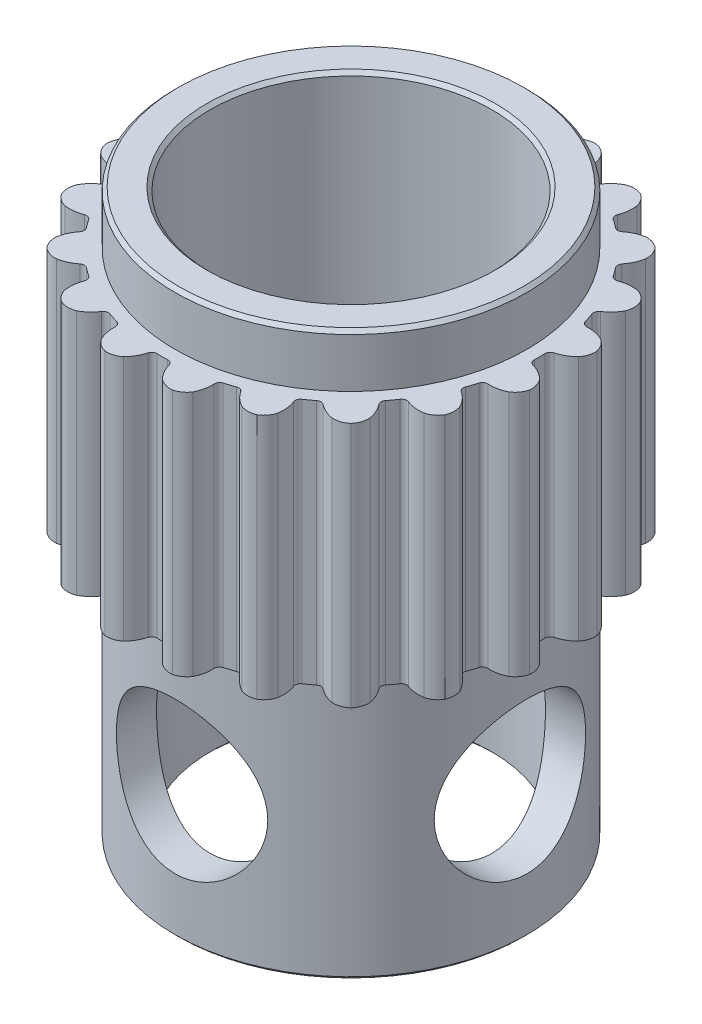
from build123d import *

# Parameters (mm, degrees)
BODY_SKETCH_W                   = 2.11
BODY_SKETCH_H                   = 7
GT2_PROFILE_DEPTH               = 3.5
GT2_CIRCULAR_PATTERN_COUNT      = 20
TOP_WALL_SKETCH_R               = 5
TOP_WALL_SKETCH_R_2             = 4
TOP_WALL_DEPTH                  = 1.5
BOTTOM_START                    = 7.5
BOTTOMWALLS_R                   = 5
BOTTOMWALLS_R_2                 = 4
BOTTOM_WALL_DEPTH               = 7.5
SET_SCREW_CLEARANCE_HOLE_REACH  = 18.71
SET_SCREW_CLEARANCE_HOLE_BORE_R = 2.15
SET_SCREW_HOLE_PATTERN_COUNT    = 2
SET_SCREW_HOLE_PATTERN_ANGLE    = 90
INNER_CHAMFER_SIZE              = 0.1
OUTER_CHAMFER_SIZE              = 0.1


with BuildPart() as part:
    # Body Sketch → Body (revolve)
    with BuildSketch(Plane.XY, mode=Mode.PRIVATE) as body_sk:
        with Locations((5.055, 0)):
            Rectangle(BODY_SKETCH_W, BODY_SKETCH_H)
    revolve(body_sk.sketch.rotate(Axis((0, 3.5, 0), (0, -1, 0)), 90), axis=Axis((0, 3.5, 0), (0, -1, 0)))

    # GT2 Profile Sketch → GT2 Profile (cut, symmetric)
    with BuildSketch(Plane(origin=(0, 0, 0), x_dir=(1, 0, 0), z_dir=(0, 1, 0))):
        with BuildLine():
            ThreePointArc((0.299749921, -5.468781955), (0.244461347, -5.387479579), (0.150701934, -5.357881011))
            ThreePointArc((0.150701934, -5.357881011), (0, -5.36), (-0.150701934, -5.357881011))
            ThreePointArc((-0.150701934, -5.357881011), (-0.244461347, -5.387479579), (-0.299749921, -5.468781955))
            ThreePointArc((-0.299749921, -5.468781955), (-0.396626607, -5.703924717), (-0.549685833, -5.907025885))
            ThreePointArc((-0.549685833, -5.907025885), (-0.7593874, -6.016293358), (-0.995541542, -6.028349446))
            ThreePointArc((-0.995541542, -6.028349446), (0, -6.11), (0.995541542, -6.028349446))
            ThreePointArc((0.995541542, -6.028349446), (0.7593874, -6.016293358), (0.549685833, -5.907025885))
            ThreePointArc((0.549685833, -5.907025885), (0.396626607, -5.703924717), (0.299749921, -5.468781955))
        make_face()
    gt2_profile = extrude(amount=GT2_PROFILE_DEPTH, both=True, mode=Mode.SUBTRACT)

    # GT2 Circular Pattern: GT2 Profile ×20 about axis
    gt2_circular_pattern_axis = Axis((0, 0, 0), (0, 1, 0))
    for i in range(1, GT2_CIRCULAR_PATTERN_COUNT):
        add(gt2_profile.rotate(gt2_circular_pattern_axis, i * 360 / GT2_CIRCULAR_PATTERN_COUNT), mode=Mode.SUBTRACT)

    # Top Wall Sketch → Top Wall (add)
    with BuildSketch(Plane(origin=(0, 3.5, 0), x_dir=(1, 0, 0), z_dir=(0, 1, 0))):
        with Locations(Location((0, 0, 0), (0, 0, 90))):
            Circle(TOP_WALL_SKETCH_R)
        with Locations(Location((0, 0, 0), (0, 0, 270))):
            Circle(TOP_WALL_SKETCH_R_2, mode=Mode.SUBTRACT)
    extrude(amount=TOP_WALL_DEPTH)

    # BottomWallS → Bottom Wall (add)
    with BuildSketch(Plane(origin=(0, -3.5, 0), x_dir=(-1, 0, 0), z_dir=(0, -1, 0)).offset(BOTTOM_START)):
        with Locations(Location((0, 0, 0), (0, 0, 90))):
            Circle(BOTTOMWALLS_R)
        with Locations(Location((0, 0, 0), (0, 0, 270))):
            Circle(BOTTOMWALLS_R_2, mode=Mode.SUBTRACT)
    extrude(amount=-BOTTOM_WALL_DEPTH)

    # Set Screw Clearance Hole bore → Set Screw Clearance Hole (cut, up to next)
    with BuildSketch(Plane.XY.offset(5), mode=Mode.PRIVATE) as set_screw_clearance_hole_sk1:
        with Locations((0, -7.25)):
            Circle(SET_SCREW_CLEARANCE_HOLE_BORE_R)
    set_screw_clearance_hole_tool1 = extrude(set_screw_clearance_hole_sk1.sketch, amount=-SET_SCREW_CLEARANCE_HOLE_REACH, mode=Mode.PRIVATE) & part.part
    set_screw_clearance_hole = set_screw_clearance_hole_tool1.solids().sort_by_distance((0, -7.25, 5))[0]
    add(set_screw_clearance_hole, mode=Mode.SUBTRACT)

    # Set Screw Hole Pattern: Set Screw Clearance Hole ×2 about axis
    set_screw_hole_pattern_axis = Axis((0, -11, 0), (0, 1, 0))
    for i in range(1, SET_SCREW_HOLE_PATTERN_COUNT):
        add(set_screw_clearance_hole.rotate(set_screw_hole_pattern_axis, i * SET_SCREW_HOLE_PATTERN_ANGLE / (SET_SCREW_HOLE_PATTERN_COUNT - 1)), mode=Mode.SUBTRACT)

    # Inner Chamfer
    inner_chamfer_edges = [part.edges().sort_by_distance(p)[0] for p in [
        (0, 5, -4),
        (0, -11, -4),
    ]]
    chamfer(inner_chamfer_edges, length=INNER_CHAMFER_SIZE)

    # Outer Chamfer
    outer_chamfer_edges = [part.edges().sort_by_distance(p)[0] for p in [
        (0, 5, 5),
        (0, -11, 5),
    ]]
    chamfer(outer_chamfer_edges, length=OUTER_CHAMFER_SIZE)


solid = part.part
